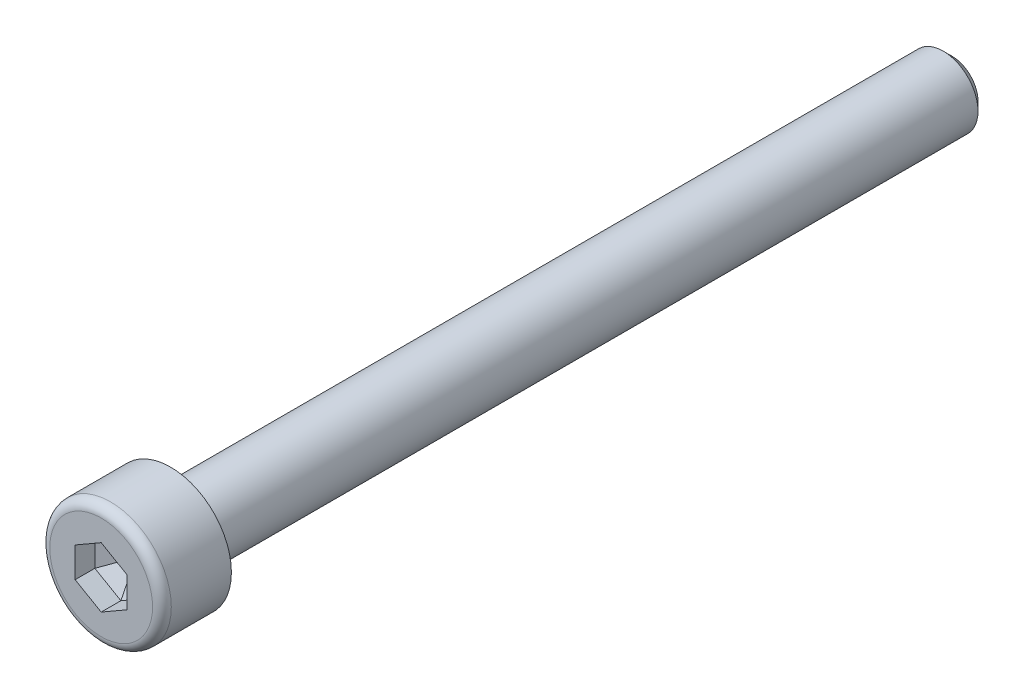
from build123d import *
from OCP.BRepFilletAPI import BRepFilletAPI_MakeChamfer

# Parameters (mm, degrees)
SKETCH_1_R          = 3.5
EXTRUDE_1_DEPTH     = 4
CUT_EXTRUDE_1_DEPTH = 2
SKETCH_3_R          = 2
EXTRUDE_2_DEPTH     = 45
CHAMFER_1_SIZE      = 0.5
FILLET_1_R          = 0.538461538
CHAMFER_2_SIZE      = 0.864553314
CHAMFER_2_SIZE2     = 1.497450266
FILLET_2_R          = 0.1


with BuildPart() as part:
    # 草图1 → 凸台-拉伸1 (new body)
    with BuildSketch(Plane.XY):
        Circle(SKETCH_1_R)
    extrude(amount=EXTRUDE_1_DEPTH)

    # 草图2 → 切除-拉伸1 (cut)
    with BuildSketch(Plane.XY.offset(4)):
        Polygon((1.5, 0.866025404), (0, 1.732050808), (-1.5, 0.866025404), (-1.5, -0.866025404), (0, -1.732050808), (1.5, -0.866025404), align=None)
    extrude(amount=-CUT_EXTRUDE_1_DEPTH, mode=Mode.SUBTRACT)

    # 草图3 → 凸台-拉伸2 (add)
    with BuildSketch(Plane(origin=(0, 0, 0), x_dir=(-1, 0, 0), z_dir=(0, 0, -1))):
        Circle(SKETCH_3_R)
    extrude(amount=EXTRUDE_2_DEPTH)

    # 倒角1
    chamfer_1_edges = [part.edges().sort_by_distance(p)[0] for p in [
        (2, 0, -45),
    ]]
    chamfer(chamfer_1_edges, length=CHAMFER_1_SIZE)

    # 圆角1
    fillet_1_edges = [part.edges().sort_by_distance(p)[0] for p in [
        (-3.5, 0, 4),
    ]]
    fillet(fillet_1_edges, radius=FILLET_1_R)

    # 倒角2: one chamfer whose edges measure the first distance from different faces: ONE call of the kernel's chamfer builder (chamfer() names one face for all edges)
    chamfer_2_edges_1 = [part.edges().sort_by_distance(p)[0] for p in [
        (-1.5, 0, 2),
    ]]
    chamfer_2_side_1 = [part.faces().sort_by_distance(p)[0] for p in [
        (-1.5, 0, 3),
    ]]
    chamfer_2_edges_2 = [part.edges().sort_by_distance(p)[0] for p in [
        (-0.75, 1.299038106, 2),
    ]]
    chamfer_2_side_2 = [part.faces().sort_by_distance(p)[0] for p in [
        (-0.75, 1.299038106, 3),
    ]]
    chamfer_2_edges_3 = [part.edges().sort_by_distance(p)[0] for p in [
        (0.75, 1.299038106, 2),
    ]]
    chamfer_2_side_3 = [part.faces().sort_by_distance(p)[0] for p in [
        (0.75, 1.299038106, 3),
    ]]
    chamfer_2_edges_4 = [part.edges().sort_by_distance(p)[0] for p in [
        (1.5, 0, 2),
    ]]
    chamfer_2_side_4 = [part.faces().sort_by_distance(p)[0] for p in [
        (1.5, 0, 3),
    ]]
    chamfer_2_edges_5 = [part.edges().sort_by_distance(p)[0] for p in [
        (-0.75, -1.299038106, 2),
    ]]
    chamfer_2_side_5 = [part.faces().sort_by_distance(p)[0] for p in [
        (-0.75, -1.299038106, 3),
    ]]
    chamfer_2_edges_6 = [part.edges().sort_by_distance(p)[0] for p in [
        (0.75, -1.299038106, 2),
    ]]
    chamfer_2_side_6 = [part.faces().sort_by_distance(p)[0] for p in [
        (0.75, -1.299038106, 3),
    ]]
    chamfer_2 = BRepFilletAPI_MakeChamfer(part.part.solid().wrapped)
    for e in chamfer_2_edges_1:
        chamfer_2.Add(CHAMFER_2_SIZE, CHAMFER_2_SIZE2, e.wrapped, chamfer_2_side_1[0].wrapped)  # the first distance lies on this face
    for e in chamfer_2_edges_2:
        chamfer_2.Add(CHAMFER_2_SIZE, CHAMFER_2_SIZE2, e.wrapped, chamfer_2_side_2[0].wrapped)  # the first distance lies on this face
    for e in chamfer_2_edges_3:
        chamfer_2.Add(CHAMFER_2_SIZE, CHAMFER_2_SIZE2, e.wrapped, chamfer_2_side_3[0].wrapped)  # the first distance lies on this face
    for e in chamfer_2_edges_4:
        chamfer_2.Add(CHAMFER_2_SIZE, CHAMFER_2_SIZE2, e.wrapped, chamfer_2_side_4[0].wrapped)  # the first distance lies on this face
    for e in chamfer_2_edges_5:
        chamfer_2.Add(CHAMFER_2_SIZE, CHAMFER_2_SIZE2, e.wrapped, chamfer_2_side_5[0].wrapped)  # the first distance lies on this face
    for e in chamfer_2_edges_6:
        chamfer_2.Add(CHAMFER_2_SIZE, CHAMFER_2_SIZE2, e.wrapped, chamfer_2_side_6[0].wrapped)  # the first distance lies on this face
    add(Compound.cast(chamfer_2.Shape()), mode=Mode.REPLACE)

    # 圆角2
    fillet_2_edges = [part.edges().sort_by_distance(p)[0] for p in [
        (2, 0, 0),
    ]]
    fillet(fillet_2_edges, radius=FILLET_2_R)


solid = part.part
